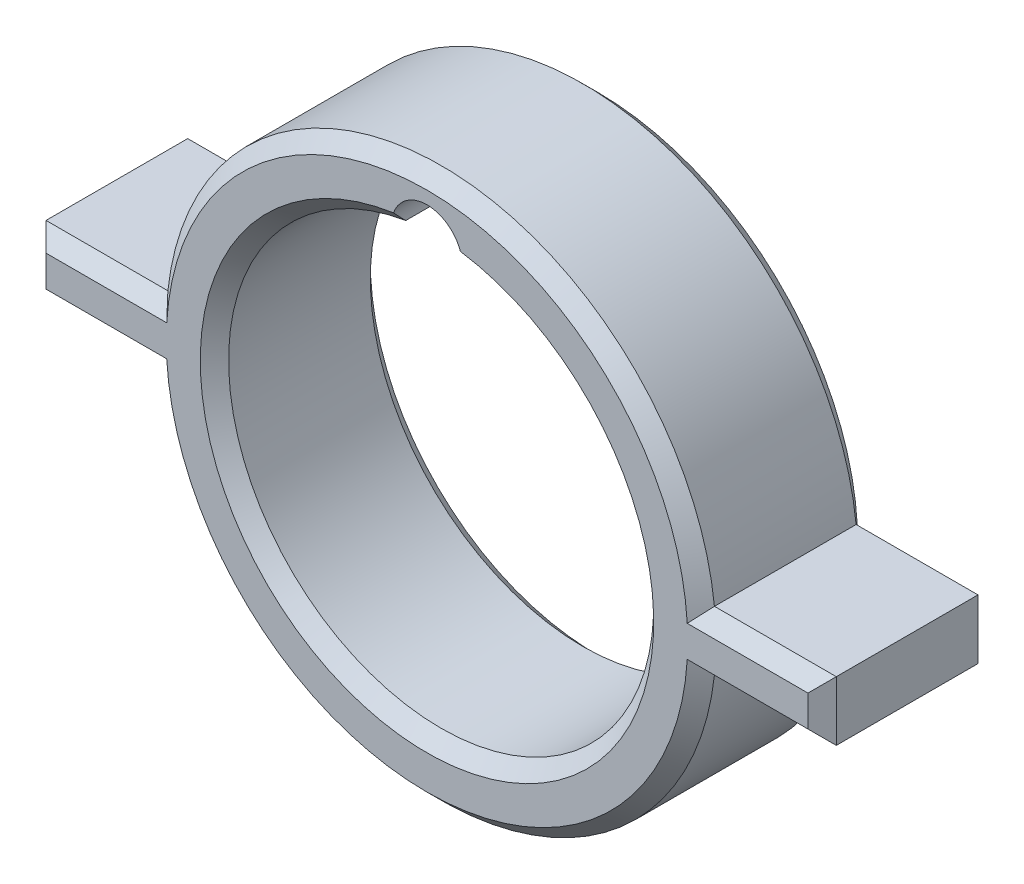
from build123d import *

# Parameters (mm, degrees)
SKETCH1_R           = 7.5
BOSS_EXTRUDE1_DEPTH = 6
CHAMFER1_SIZE       = 0.5
SKETCH2_R           = 1.25
CUT_EXTRUDE1_DEPTH  = 10


with BuildPart() as part:
    # Sketch1 → Boss-Extrude1 (new body)
    with BuildSketch(Plane.XY):
        with BuildLine():
            Line((9.643002644, -1.05), (13.943002644, -1.05))
            Line((13.943002644, -1.05), (13.943002644, 1.05))
            Line((13.943002644, 1.05), (9.643002644, 1.05))
            ThreePointArc((9.643002644, 1.05), (0, 9.7), (-9.643002644, 1.05))
            Line((-9.643002644, 1.05), (-13.943002644, 1.05))
            Line((-13.943002644, 1.05), (-13.943002644, -1.05))
            Line((-13.943002644, -1.05), (-9.643002644, -1.05))
            ThreePointArc((-9.643002644, -1.05), (0, -9.7), (9.643002644, -1.05))
        make_face()
        Circle(SKETCH1_R, mode=Mode.SUBTRACT)
    extrude(amount=BOSS_EXTRUDE1_DEPTH)

    # Chamfer1
    chamfer1_edges = [part.edges().sort_by_distance(p)[0] for p in [
        (0, -9.7, 0),
        (-11.793002644, -1.05, 0),
        (-13.943002644, 0, 0),
        (-11.793002644, 1.05, 0),
        (-11.793002644, -1.05, 6),
        (0, -9.7, 6),
        (11.793002644, -1.05, 6),
        (-7.5, 0, 0),
        (-7.5, 0, 6),
        (13.943002644, 0, 6),
        (11.793002644, 1.05, 6),
        (0, 9.7, 6),
        (-11.793002644, 1.05, 6),
        (0, 9.7, 0),
        (-13.943002644, 0, 6),
        (11.793002644, 1.05, 0),
        (13.943002644, 0, 0),
        (11.793002644, -1.05, 0),
    ]]
    chamfer(chamfer1_edges, length=CHAMFER1_SIZE)

    # Sketch2 → Cut-Extrude1 (cut)
    with BuildSketch(Plane(origin=(0, 0, 0), x_dir=(-1, 0, 0), z_dir=(0, 0, -1))):
        with Locations((0, 7.5)):
            Circle(SKETCH2_R)
    extrude(amount=-CUT_EXTRUDE1_DEPTH, mode=Mode.SUBTRACT)


solid = part.part
